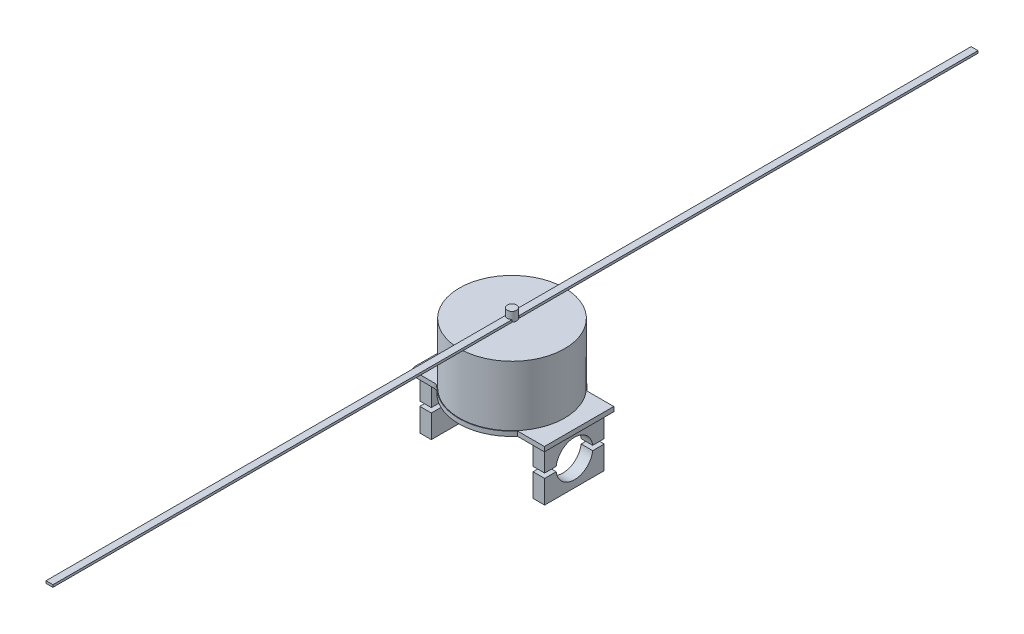
from build123d import *

# Parameters (mm, degrees)
BOSS_EXTRUDE1_DEPTH   = 2
BOSS_EXTRUDE2_DEPTH   = 27
BOSS_EXTRUDE2_2_DEPTH = 27
SKETCH4_W             = 44
SKETCH4_H             = 31.621569558
CUT_EXTRUDE1_DEPTH    = 52.116205304
SKETCH5_R             = 1.25
CUT_EXTRUDE2_DEPTH    = 45.11349
SKETCH6_R             = 22.75
BOSS_EXTRUDE3_DEPTH   = 26
SKETCH7_R             = 2
BOSS_EXTRUDE4_DEPTH   = 4
FILLET1_R             = 2
BOSS_EXTRUDE5_DEPTH   = 1
BOSS_EXTRUDE5_2_DEPTH = 1


with BuildPart() as part:
    # Sketch1 → Boss-Extrude1 (new body)
    with BuildSketch(Plane(origin=(0, 0, 0), x_dir=(1, 0, 0), z_dir=(0, 1, 0))):
        with BuildLine():
            Line((-17.435595774, 15), (-29, 15))
            Line((-29, 15), (-29, -15))
            Line((-29, -15), (-17.435595774, -15))
            ThreePointArc((-17.435595774, -15), (0, -23), (17.435595774, -15))
            Line((17.435595774, -15), (29, -15))
            Line((29, -15), (29, 15))
            Line((29, 15), (17.435595774, 15))
            ThreePointArc((17.435595774, 15), (0, 23), (-17.435595774, 15))
        make_face()
    extrude(amount=BOSS_EXTRUDE1_DEPTH)

    # Sketch5 → Cut-Extrude2 (cut, through all)
    with BuildSketch(Plane(origin=(0, 2, 0), x_dir=(1, 0, 0), z_dir=(0, 1, 0))):
        with Locations(Location((0, 16, 0), (0, 0, 270))):
            Circle(SKETCH5_R)
        with Locations(Location((16, 0, 0), (0, 0, 270))):
            Circle(SKETCH5_R)
        with Locations(Location((0, -16, 0), (0, 0, 270))):
            Circle(SKETCH5_R)
        with Locations(Location((-16, 0, 0), (0, 0, 270))):
            Circle(SKETCH5_R)
    extrude(amount=-CUT_EXTRUDE2_DEPTH, mode=Mode.SUBTRACT)

    # Fillet1
    fillet1_edges = [part.edges().sort_by_distance(p)[0] for p in [
        (-29, 1, 15),
        (-29, 1, -15),
        (-17.435595774, 1, -15),
        (-17.435595774, 1, 15),
    ]]
    fillet(fillet1_edges, radius=FILLET1_R)


with BuildPart() as body_2:
    # Sketch2 → Boss-Extrude2 (new, symmetric)
    with BuildSketch(Plane.ZY):
        with BuildLine():
            Line((-12.886856154, -10), (-12.886856154, 0))
            Line((-12.886856154, 0), (12.886856154, 0))
            Line((12.886856154, 0), (12.886856154, -10))
            Line((12.886856154, -10), (7.886856154, -10))
            ThreePointArc((7.886856154, -10), (0, -3.05), (-7.886856154, -10))
            Line((-7.886856154, -10), (-12.886856154, -10))
        make_face()
    extrude(amount=BOSS_EXTRUDE2_DEPTH, both=True)


with BuildPart() as body_3:
    # Sketch2 → Boss-Extrude2 2 (new, symmetric)
    with BuildSketch(Plane.ZY):
        with BuildLine():
            Line((7.886856154, -12), (12.886856154, -12))
            Line((12.886856154, -12), (12.886856154, -22))
            Line((12.886856154, -22), (-12.886856154, -22))
            Line((-12.886856154, -22), (-12.886856154, -12))
            Line((-12.886856154, -12), (-7.886856154, -12))
            ThreePointArc((-7.886856154, -12), (0, -18.95), (7.886856154, -12))
        make_face()
    extrude(amount=BOSS_EXTRUDE2_2_DEPTH, both=True)


with BuildPart() as cut_extrude1_tool:
    # Sketch4 → Cut-Extrude1 (new, through all)
    with BuildSketch(Plane(origin=(0, 0, -12.886856154), x_dir=(-1, 0, 0), z_dir=(0, 0, -1))):
        with Locations((0, -15.810784779)):
            Rectangle(SKETCH4_W, SKETCH4_H)
    extrude(amount=-CUT_EXTRUDE1_DEPTH)


with BuildPart() as body_2_1:
    add(body_2.part)

    # Cut-Extrude1: cut by cut_extrude1_tool
    add(cut_extrude1_tool.part, mode=Mode.SUBTRACT)


with BuildPart() as body_3_1:
    add(body_3.part)

    # Cut-Extrude1: cut by cut_extrude1_tool
    add(cut_extrude1_tool.part, mode=Mode.SUBTRACT)


with BuildPart() as cut_extrude1_piece_1:
    # of the separate pieces the step leaves, piece 1, a body of its own (cut_extrude1_pieces)
    add(body_2_1.part.solids().sort_by_distance((27, -10, -7.886856154))[0])


with BuildPart() as cut_extrude1_piece_2:
    # of the separate pieces the step leaves, piece 2, a body of its own (cut_extrude1_pieces)
    add(body_2_1.part.solids().sort_by_distance((-22, -10, -7.886856154))[0])


with BuildPart() as cut_extrude1_piece_1_of_body_3:
    # of the separate pieces the step leaves, piece 1, a body of its own (cut_extrude1_pieces_of_body_3)
    add(body_3_1.part.solids().sort_by_distance((27, -12, 7.886856154))[0])


with BuildPart() as cut_extrude1_piece_2_of_body_3:
    # of the separate pieces the step leaves, piece 2, a body of its own (cut_extrude1_pieces_of_body_3)
    add(body_3_1.part.solids().sort_by_distance((-22, -12, 7.886856154))[0])


with BuildPart() as body_6:
    # Sketch6 → Boss-Extrude3 (new body)
    with BuildSketch(Plane(origin=(0, 2, 0), x_dir=(1, 0, 0), z_dir=(0, 1, 0))):
        with Locations(Location((0, 0, 0), (0, 0, 90))):
            Circle(SKETCH6_R)
    extrude(amount=BOSS_EXTRUDE3_DEPTH)

    # Sketch7 → Boss-Extrude4 (add)
    with BuildSketch(Plane(origin=(0, 28, 0), x_dir=(1, 0, 0), z_dir=(0, 1, 0))):
        with Locations(Location((0, 0, 0), (0, 0, 270))):
            Circle(SKETCH7_R)
    extrude(amount=BOSS_EXTRUDE4_DEPTH)


with BuildPart() as body_7:
    # Sketch8 → Boss-Extrude5 (new body)
    with BuildSketch(Plane(origin=(0, 28, 0), x_dir=(1, 0, 0), z_dir=(0, 1, 0))):
        with BuildLine():
            Line((-1.5, -1.5), (-1.5, -200))
            Line((-1.5, -200), (1.5, -200))
            Line((1.5, -200), (1.5, -1.5))
            Line((1.5, -1.5), (1.322875656, -1.5))
            ThreePointArc((1.322875656, -1.5), (0, -2), (-1.322875656, -1.5))
            Line((-1.322875656, -1.5), (-1.5, -1.5))
        make_face()
    extrude(amount=BOSS_EXTRUDE5_DEPTH)


with BuildPart() as body_8:
    # Sketch8 → Boss-Extrude5 2 (new body)
    with BuildSketch(Plane(origin=(0, 28, 0), x_dir=(1, 0, 0), z_dir=(0, 1, 0))):
        with BuildLine():
            Line((-1.5, 200), (-1.5, 1.5))
            Line((-1.5, 1.5), (-1.322875656, 1.5))
            ThreePointArc((-1.322875656, 1.5), (0, 2), (1.322875656, 1.5))
            Line((1.322875656, 1.5), (1.5, 1.5))
            Line((1.5, 1.5), (1.5, 200))
            Line((1.5, 200), (-1.5, 200))
        make_face()
    extrude(amount=BOSS_EXTRUDE5_2_DEPTH)


solid = Compound([part.part, cut_extrude1_piece_1.part, cut_extrude1_piece_2.part, cut_extrude1_piece_1_of_body_3.part, cut_extrude1_piece_2_of_body_3.part, body_6.part, body_7.part, body_8.part])
